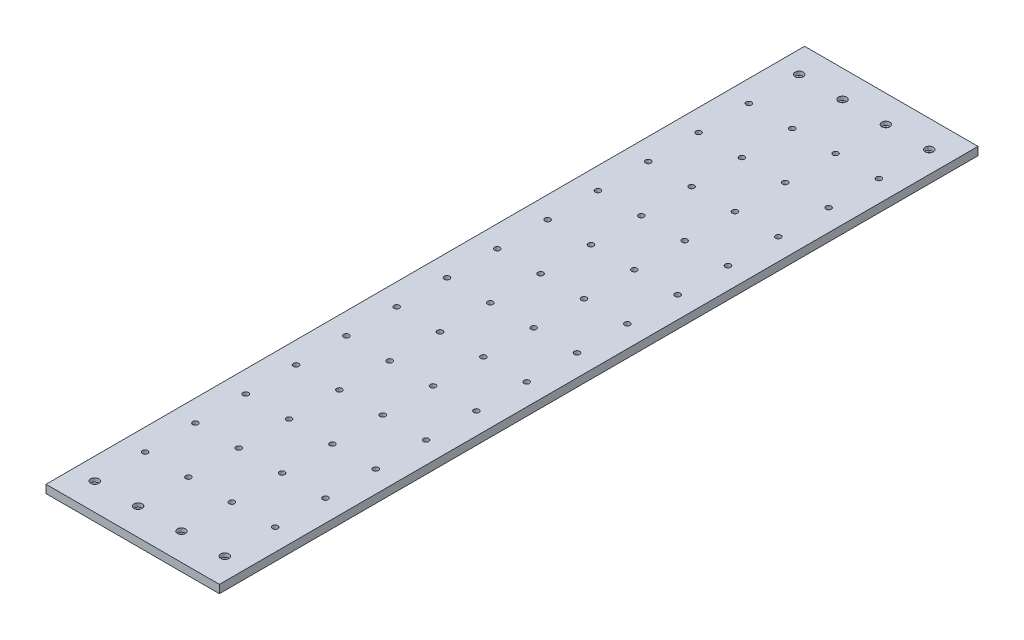
from build123d import *

# Parameters (mm, degrees)
SKETCH1_W           = 203.2
SKETCH1_H           = 889
BOSS_EXTRUDE1_DEPTH = 9.525
SKETCH2_R           = 3.175
CUT_EXTRUDE1_DEPTH  = 457.063082945
BOSS_EXTRUDE3_START = -5.08
SKETCH10_R          = 3.175
SKETCH10_R_2        = 2.5
BOSS_EXTRUDE3_DEPTH = 5.08
SKETCH11_R          = 4.7625
CUT_EXTRUDE2_DEPTH  = 4.445


with BuildPart() as part:
    # Sketch1 → Boss-Extrude1 (new body)
    with BuildSketch(Plane(origin=(0, 0, 0), x_dir=(1, 0, 0), z_dir=(0, 1, 0))):
        Rectangle(SKETCH1_W, SKETCH1_H)
    extrude(amount=BOSS_EXTRUDE1_DEPTH)

    # Sketch2 → Cut-Extrude1 (cut, through all)
    with BuildSketch(Plane(origin=(0, 9.525, 0), x_dir=(1, 0, 0), z_dir=(0, 1, 0))):
        with Locations(Location((-76.2, -412.75, 0), (0, 0, 270))):
            Circle(SKETCH2_R)
        with Locations(Location((-25.4, -412.75, 0), (0, 0, 270))):
            Circle(SKETCH2_R)
        with Locations(Location((25.4, -412.75, 0), (0, 0, 270))):
            Circle(SKETCH2_R)
        with Locations(Location((-76.2, -353.785714286, 0), (0, 0, 270))):
            Circle(SKETCH2_R)
        with Locations(Location((-25.4, -353.785714286, 0), (0, 0, 270))):
            Circle(SKETCH2_R)
        with Locations(Location((25.4, -353.785714286, 0), (0, 0, 270))):
            Circle(SKETCH2_R)
        with Locations(Location((-76.2, -294.821428571, 0), (0, 0, 270))):
            Circle(SKETCH2_R)
        with Locations(Location((-25.4, -294.821428571, 0), (0, 0, 270))):
            Circle(SKETCH2_R)
        with Locations(Location((25.4, -294.821428571, 0), (0, 0, 270))):
            Circle(SKETCH2_R)
        with Locations(Location((-76.2, -235.857142857, 0), (0, 0, 270))):
            Circle(SKETCH2_R)
        with Locations(Location((-25.4, -235.857142857, 0), (0, 0, 270))):
            Circle(SKETCH2_R)
        with Locations(Location((25.4, -235.857142857, 0), (0, 0, 270))):
            Circle(SKETCH2_R)
        with Locations(Location((-76.2, -176.892857143, 0), (0, 0, 270))):
            Circle(SKETCH2_R)
        with Locations(Location((-25.4, -176.892857143, 0), (0, 0, 270))):
            Circle(SKETCH2_R)
        with Locations(Location((25.4, -176.892857143, 0), (0, 0, 270))):
            Circle(SKETCH2_R)
        with Locations(Location((-76.2, -117.928571429, 0), (0, 0, 270))):
            Circle(SKETCH2_R)
        with Locations(Location((-25.4, -117.928571429, 0), (0, 0, 270))):
            Circle(SKETCH2_R)
        with Locations(Location((25.4, -117.928571429, 0), (0, 0, 270))):
            Circle(SKETCH2_R)
        with Locations(Location((-76.2, -58.964285714, 0), (0, 0, 270))):
            Circle(SKETCH2_R)
        with Locations(Location((-25.4, -58.964285714, 0), (0, 0, 270))):
            Circle(SKETCH2_R)
        with Locations(Location((25.4, -58.964285714, 0), (0, 0, 270))):
            Circle(SKETCH2_R)
        with Locations(Location((-76.2, 0, 0), (0, 0, 270))):
            Circle(SKETCH2_R)
        with Locations(Location((-25.4, 0, 0), (0, 0, 270))):
            Circle(SKETCH2_R)
        with Locations(Location((25.4, 0, 0), (0, 0, 270))):
            Circle(SKETCH2_R)
        with Locations(Location((-76.2, 58.964285714, 0), (0, 0, 270))):
            Circle(SKETCH2_R)
        with Locations(Location((-25.4, 58.964285714, 0), (0, 0, 270))):
            Circle(SKETCH2_R)
        with Locations(Location((25.4, 58.964285714, 0), (0, 0, 270))):
            Circle(SKETCH2_R)
        with Locations(Location((-76.2, 117.928571429, 0), (0, 0, 270))):
            Circle(SKETCH2_R)
        with Locations(Location((-25.4, 117.928571429, 0), (0, 0, 270))):
            Circle(SKETCH2_R)
        with Locations(Location((25.4, 117.928571429, 0), (0, 0, 270))):
            Circle(SKETCH2_R)
        with Locations(Location((-76.2, 176.892857143, 0), (0, 0, 270))):
            Circle(SKETCH2_R)
        with Locations(Location((-25.4, 176.892857143, 0), (0, 0, 270))):
            Circle(SKETCH2_R)
        with Locations(Location((25.4, 176.892857143, 0), (0, 0, 270))):
            Circle(SKETCH2_R)
        with Locations(Location((-76.2, 235.857142857, 0), (0, 0, 270))):
            Circle(SKETCH2_R)
        with Locations(Location((-25.4, 235.857142857, 0), (0, 0, 270))):
            Circle(SKETCH2_R)
        with Locations(Location((25.4, 235.857142857, 0), (0, 0, 270))):
            Circle(SKETCH2_R)
        with Locations(Location((-76.2, 294.821428571, 0), (0, 0, 270))):
            Circle(SKETCH2_R)
        with Locations(Location((-25.4, 294.821428571, 0), (0, 0, 270))):
            Circle(SKETCH2_R)
        with Locations(Location((25.4, 294.821428571, 0), (0, 0, 270))):
            Circle(SKETCH2_R)
        with Locations(Location((-76.2, 353.785714286, 0), (0, 0, 270))):
            Circle(SKETCH2_R)
        with Locations(Location((-25.4, 353.785714286, 0), (0, 0, 270))):
            Circle(SKETCH2_R)
        with Locations(Location((25.4, 353.785714286, 0), (0, 0, 270))):
            Circle(SKETCH2_R)
        with Locations(Location((-76.2, 412.75, 0), (0, 0, 270))):
            Circle(SKETCH2_R)
        with Locations(Location((-25.4, 412.75, 0), (0, 0, 270))):
            Circle(SKETCH2_R)
        with Locations(Location((25.4, 412.75, 0), (0, 0, 270))):
            Circle(SKETCH2_R)
        with Locations(Location((76.2, -412.75, 0), (0, 0, 270))):
            Circle(SKETCH2_R)
        with Locations(Location((76.2, -353.785714286, 0), (0, 0, 270))):
            Circle(SKETCH2_R)
        with Locations(Location((76.2, -294.821428571, 0), (0, 0, 270))):
            Circle(SKETCH2_R)
        with Locations(Location((76.2, -235.857142857, 0), (0, 0, 270))):
            Circle(SKETCH2_R)
        with Locations(Location((76.2, -176.892857143, 0), (0, 0, 270))):
            Circle(SKETCH2_R)
        with Locations(Location((76.2, -117.928571429, 0), (0, 0, 270))):
            Circle(SKETCH2_R)
        with Locations(Location((76.2, -58.964285714, 0), (0, 0, 270))):
            Circle(SKETCH2_R)
        with Locations(Location((76.2, 0, 0), (0, 0, 270))):
            Circle(SKETCH2_R)
        with Locations(Location((76.2, 58.964285714, 0), (0, 0, 270))):
            Circle(SKETCH2_R)
        with Locations(Location((76.2, 117.928571429, 0), (0, 0, 270))):
            Circle(SKETCH2_R)
        with Locations(Location((76.2, 176.892857143, 0), (0, 0, 270))):
            Circle(SKETCH2_R)
        with Locations(Location((76.2, 235.857142857, 0), (0, 0, 270))):
            Circle(SKETCH2_R)
        with Locations(Location((76.2, 294.821428571, 0), (0, 0, 270))):
            Circle(SKETCH2_R)
        with Locations(Location((76.2, 353.785714286, 0), (0, 0, 270))):
            Circle(SKETCH2_R)
        with Locations(Location((76.2, 412.75, 0), (0, 0, 270))):
            Circle(SKETCH2_R)
    extrude(amount=-CUT_EXTRUDE1_DEPTH, mode=Mode.SUBTRACT)

    # Sketch10 → Boss-Extrude3 (add)
    # profile 1 of 8: a face of its own
    with BuildSketch(Plane.XZ.offset(BOSS_EXTRUDE3_START)):
        with Locations(Location((76.2, -412.75, 0), (0, 0, 90))):
            Circle(SKETCH10_R)
        with Locations(Location((76.2, -412.75, 0), (0, 0, 270))):
            Circle(SKETCH10_R_2, mode=Mode.SUBTRACT)
    # profile 2 of 8: a face of its own
    with BuildSketch(Plane.XZ.offset(BOSS_EXTRUDE3_START)):
        with Locations(Location((25.4, -412.75, 0), (0, 0, 90))):
            Circle(SKETCH10_R)
        with Locations(Location((25.4, -412.75, 0), (0, 0, 270))):
            Circle(SKETCH10_R_2, mode=Mode.SUBTRACT)
    # profile 3 of 8: a face of its own
    with BuildSketch(Plane.XZ.offset(BOSS_EXTRUDE3_START)):
        with Locations(Location((-25.4, -412.75, 0), (0, 0, 90))):
            Circle(SKETCH10_R)
        with Locations(Location((-25.4, -412.75, 0), (0, 0, 270))):
            Circle(SKETCH10_R_2, mode=Mode.SUBTRACT)
    # profile 4 of 8: a face of its own
    with BuildSketch(Plane.XZ.offset(BOSS_EXTRUDE3_START)):
        with Locations(Location((-76.2, -412.75, 0), (0, 0, 90))):
            Circle(SKETCH10_R)
        with Locations(Location((-76.2, -412.75, 0), (0, 0, 270))):
            Circle(SKETCH10_R_2, mode=Mode.SUBTRACT)
    # profile 5 of 8: a face of its own
    with BuildSketch(Plane.XZ.offset(BOSS_EXTRUDE3_START)):
        with Locations(Location((76.2, 412.75, 0), (0, 0, 90))):
            Circle(SKETCH10_R)
        with Locations(Location((76.2, 412.75, 0), (0, 0, 270))):
            Circle(SKETCH10_R_2, mode=Mode.SUBTRACT)
    # profile 6 of 8: a face of its own
    with BuildSketch(Plane.XZ.offset(BOSS_EXTRUDE3_START)):
        with Locations(Location((25.4, 412.75, 0), (0, 0, 90))):
            Circle(SKETCH10_R)
        with Locations(Location((25.4, 412.75, 0), (0, 0, 270))):
            Circle(SKETCH10_R_2, mode=Mode.SUBTRACT)
    # profile 7 of 8: a face of its own
    with BuildSketch(Plane.XZ.offset(BOSS_EXTRUDE3_START)):
        with Locations(Location((-25.4, 412.75, 0), (0, 0, 90))):
            Circle(SKETCH10_R)
        with Locations(Location((-25.4, 412.75, 0), (0, 0, 270))):
            Circle(SKETCH10_R_2, mode=Mode.SUBTRACT)
    # profile 8 of 8: a face of its own
    with BuildSketch(Plane.XZ.offset(BOSS_EXTRUDE3_START)):
        with Locations(Location((-76.2, 412.75, 0), (0, 0, 90))):
            Circle(SKETCH10_R)
        with Locations(Location((-76.2, 412.75, 0), (0, 0, 270))):
            Circle(SKETCH10_R_2, mode=Mode.SUBTRACT)
    extrude(amount=BOSS_EXTRUDE3_DEPTH)

    # Sketch11 → Cut-Extrude2 (cut)
    with BuildSketch(Plane(origin=(0, 9.525, 0), x_dir=(1, 0, 0), z_dir=(0, 1, 0))):
        with Locations(Location((-76.2, -412.75, 0), (0, 0, 270))):
            Circle(SKETCH11_R)
        with Locations(Location((-25.4, -412.75, 0), (0, 0, 270))):
            Circle(SKETCH11_R)
        with Locations(Location((25.4, -412.75, 0), (0, 0, 270))):
            Circle(SKETCH11_R)
        with Locations(Location((76.2, -412.75, 0), (0, 0, 270))):
            Circle(SKETCH11_R)
        with Locations(Location((-76.2, 412.75, 0), (0, 0, 270))):
            Circle(SKETCH11_R)
        with Locations(Location((-25.4, 412.75, 0), (0, 0, 270))):
            Circle(SKETCH11_R)
        with Locations(Location((25.4, 412.75, 0), (0, 0, 270))):
            Circle(SKETCH11_R)
        with Locations(Location((76.2, 412.75, 0), (0, 0, 270))):
            Circle(SKETCH11_R)
    extrude(amount=-CUT_EXTRUDE2_DEPTH, mode=Mode.SUBTRACT)


solid = part.part
